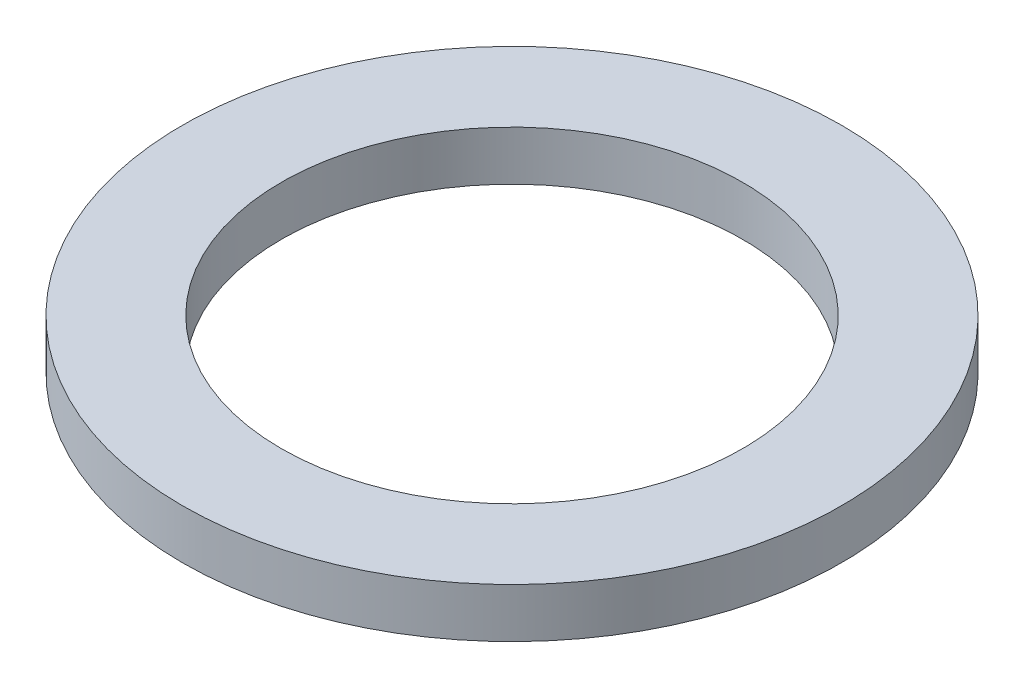
from build123d import *

# Parameters (mm, degrees)
SKETCH1_R           = 20
BOSS_EXTRUDE1_DEPTH = 3
SKETCH2_R           = 14
CUT_EXTRUDE1_DEPTH  = 3


with BuildPart() as part:
    # Sketch1 → Boss-Extrude1 (new body)
    with BuildSketch(Plane(origin=(0, 0, 0), x_dir=(1, 0, 0), z_dir=(0, 1, 0))):
        with Locations(Location((0, 0, 0), (0, 0, 270))):
            Circle(SKETCH1_R)
    extrude(amount=BOSS_EXTRUDE1_DEPTH)

    # Sketch2 → Cut-Extrude1 (cut)
    with BuildSketch(Plane(origin=(0, 3, 0), x_dir=(1, 0, 0), z_dir=(0, 1, 0))):
        with Locations(Location((0, 0, 0), (0, 0, 270))):
            Circle(SKETCH2_R)
    extrude(amount=-CUT_EXTRUDE1_DEPTH, mode=Mode.SUBTRACT)


solid = part.part
